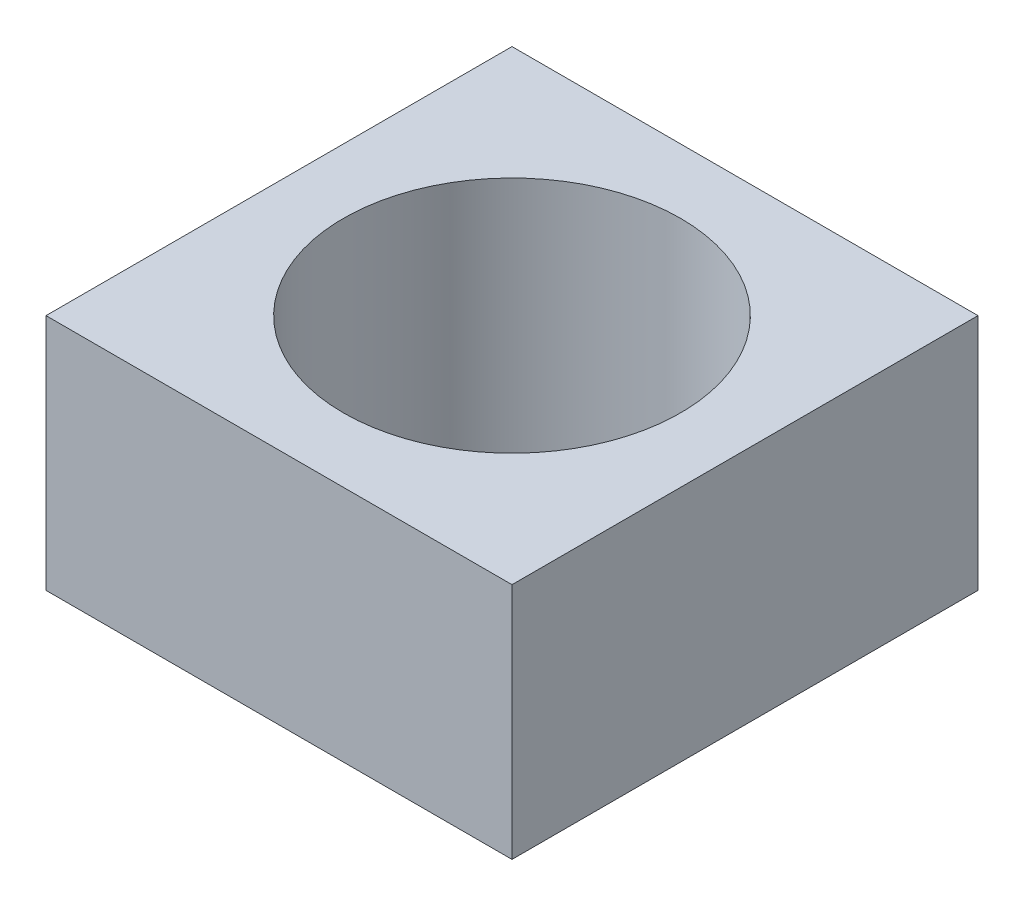
from build123d import *

# Parameters (mm, degrees)
SKETCH1_W           = 74.6125
SKETCH1_H           = 74.6125
BOSS_EXTRUDE1_DEPTH = 38.1
SKETCH2_R           = 26.9875
CUT_EXTRUDE1_DEPTH  = 66.077819402


with BuildPart() as part:
    # Sketch1 → Boss-Extrude1 (new body)
    with BuildSketch(Plane(origin=(0, 0, 0), x_dir=(1, 0, 0), z_dir=(0, 1, 0))):
        Rectangle(SKETCH1_W, SKETCH1_H)
    extrude(amount=BOSS_EXTRUDE1_DEPTH)

    # Sketch2 → Cut-Extrude1 (cut, through all)
    with BuildSketch(Plane(origin=(0, 38.1, 0), x_dir=(1, 0, 0), z_dir=(0, 1, 0))):
        with Locations(Location((0, 0, 0), (0, 0, 270))):
            Circle(SKETCH2_R)
    extrude(amount=-CUT_EXTRUDE1_DEPTH, mode=Mode.SUBTRACT)


solid = part.part
